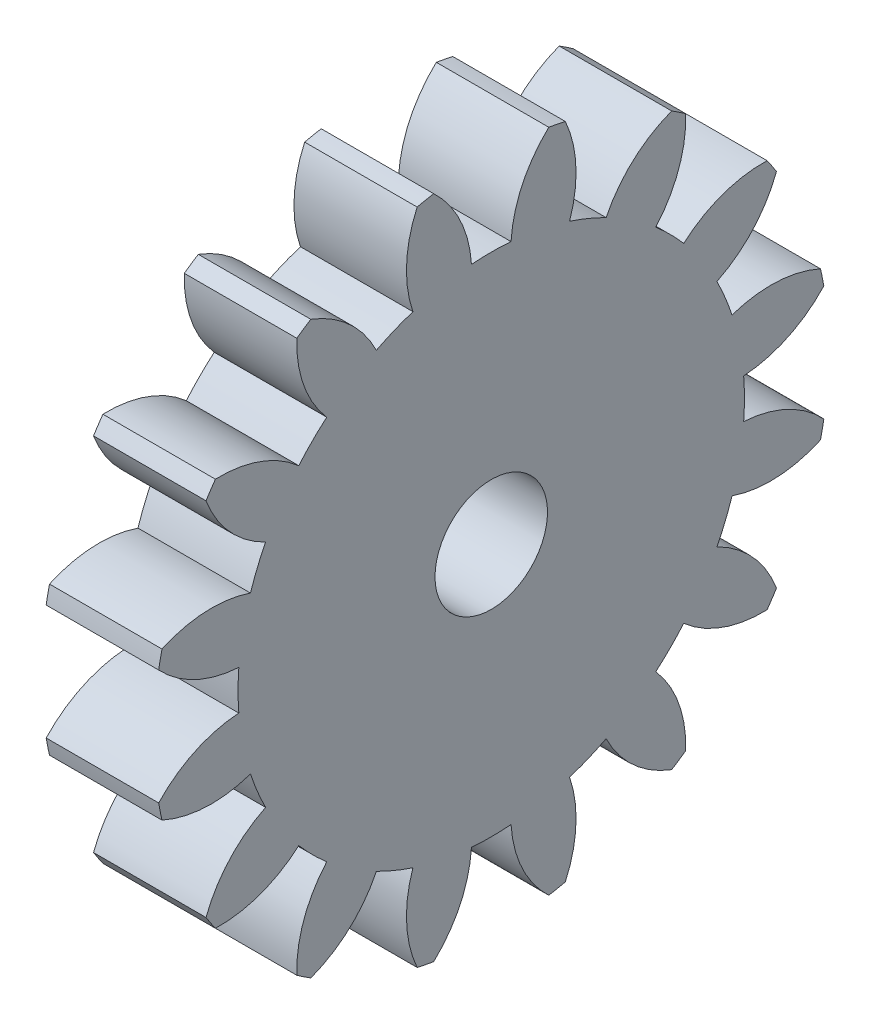
from build123d import *

# Parameters (mm, degrees)
BASPROSKE_W     = 3.175
BASPROSKE_H     = 9.525
TOOTHCUT_DEPTH  = 14.839504146
TEETHCUTS_COUNT = 16
TEETHCUTS_ANGLE = 337.5
BORSKE_R        = 1.5875
BORE_DEPTH      = 6.3500508


with BuildPart() as part:
    # BasProSke → Base-Revolve (revolve)
    with BuildSketch(Plane(origin=(0, 0, 0), x_dir=(1, 0, 0), z_dir=(0, 1, 0)), mode=Mode.PRIVATE) as base_revolve_sk:
        with Locations((1.5875, 4.7625)):
            Rectangle(BASPROSKE_W, BASPROSKE_H)
    revolve(base_revolve_sk.sketch.rotate(Axis((-10, 0, 0), (1, 0, 0)), 180), axis=Axis((-10, 0, 0), (1, 0, 0)))

    # TooCutSke → ToothCut (cut, through all)
    with BuildSketch(Plane(origin=(0, 0, 0), x_dir=(0, 0, -1), z_dir=(1, 0, 0))):
        with BuildLine():
            ThreePointArc((0.558172398, 7.124033548), (0, 7.145866667), (-0.558172398, 7.124033548))
            ThreePointArc((-0.558172398, 7.124033548), (-0.881592275, 8.371157212), (-1.647385832, 9.407245085))
            ThreePointArc((-1.647385832, 9.407245085), (0, 9.5504), (1.647385832, 9.407245085))
            ThreePointArc((1.647385832, 9.407245085), (0.881592275, 8.371157212), (0.558172398, 7.124033548))
        make_face()
    toothcut = extrude(amount=TOOTHCUT_DEPTH, mode=Mode.SUBTRACT)

    # TeethCuts: ToothCut ×16 about axis
    teethcuts_axis = Axis((-10, 0, 0), (1, 0, 0))
    for i in range(1, TEETHCUTS_COUNT):
        add(toothcut.rotate(teethcuts_axis, i * TEETHCUTS_ANGLE / (TEETHCUTS_COUNT - 1)), mode=Mode.SUBTRACT)

    # BorSke → Bore (cut, symmetric)
    with BuildSketch(Plane(origin=(0, 0, 0), x_dir=(0, 0, -1), z_dir=(1, 0, 0))):
        with Locations(Location((0, 0, 0), (0, 0, 180))):
            Circle(BORSKE_R)
    extrude(amount=BORE_DEPTH, both=True, mode=Mode.SUBTRACT)


solid = part.part
